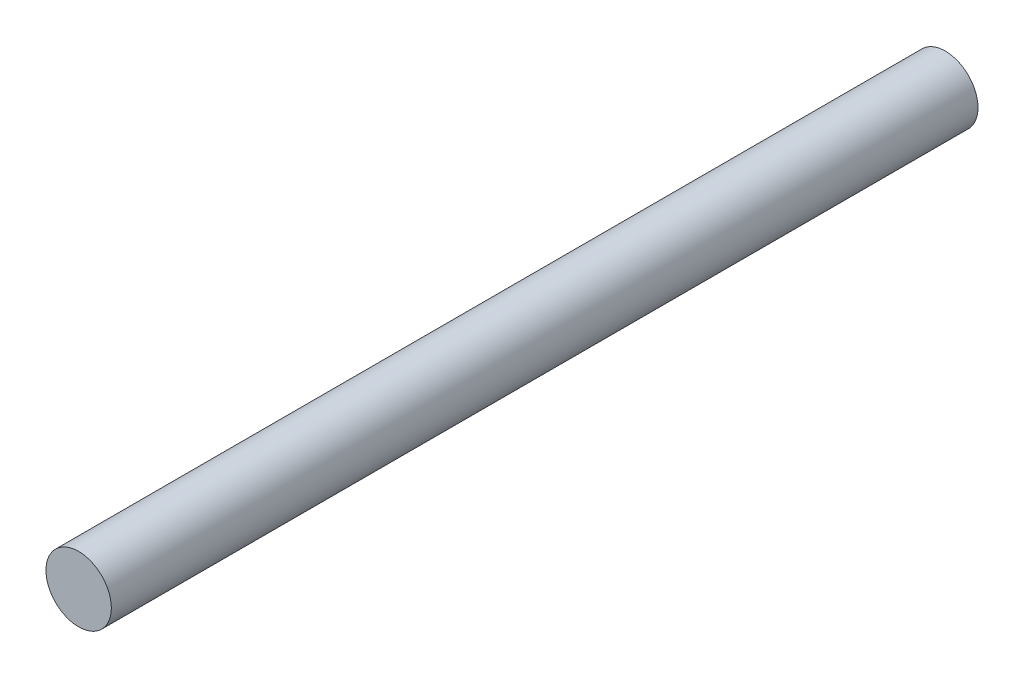
from build123d import *

# Parameters (mm, degrees)
ESQUISSE1_R        = 4
BOSS_EXTRU_1_DEPTH = 106


with BuildPart() as part:
    # Esquisse1 → Boss.-Extru.1 (new body)
    with BuildSketch(Plane.XY):
        Circle(ESQUISSE1_R)
    extrude(amount=BOSS_EXTRU_1_DEPTH)


solid = part.part
